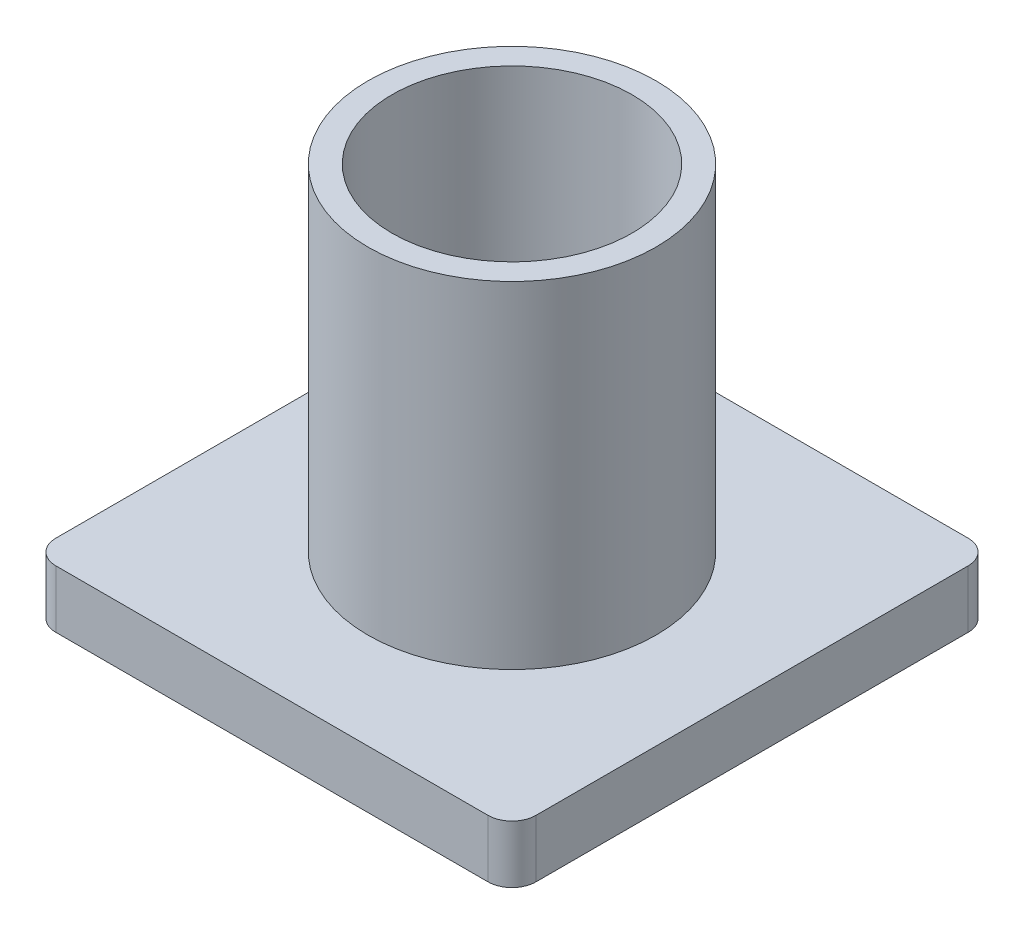
from build123d import *

# Parameters (mm, degrees)
BOSS_EXTRUDE1_DEPTH = 12
SKETCH3_R           = 30
BOSS_EXTRUDE2_DEPTH = 70
SKETCH4_R           = 25
CUT_EXTRUDE1_DEPTH  = 70


with BuildPart() as part:
    # Sketch1 → Boss-Extrude1 (new body)
    with BuildSketch(Plane(origin=(0, 0, 0), x_dir=(1, 0, 0), z_dir=(0, 1, 0))):
        with BuildLine():
            Line((-45, 50), (45, 50))
            ThreePointArc((45, 50), (48.535533906, 48.535533906), (50, 45))
            Line((50, 45), (50, -45))
            ThreePointArc((50, -45), (48.535533906, -48.535533906), (45, -50))
            Line((45, -50), (-45, -50))
            ThreePointArc((-45, -50), (-48.535533906, -48.535533906), (-50, -45))
            Line((-50, -45), (-50, 45))
            ThreePointArc((-50, 45), (-48.535533906, 48.535533906), (-45, 50))
        make_face()
    extrude(amount=BOSS_EXTRUDE1_DEPTH)

    # Sketch3 → Boss-Extrude2 (add)
    with BuildSketch(Plane(origin=(0, 12, 0), x_dir=(1, 0, 0), z_dir=(0, 1, 0))):
        with Locations(Location((0, 0, 0), (0, 0, 270))):
            Circle(SKETCH3_R)
    extrude(amount=BOSS_EXTRUDE2_DEPTH)

    # Sketch4 → Cut-Extrude1 (cut)
    with BuildSketch(Plane(origin=(0, 82, 0), x_dir=(1, 0, 0), z_dir=(0, 1, 0))):
        with Locations(Location((0, 0, 0), (0, 0, 270))):
            Circle(SKETCH4_R)
    extrude(amount=-CUT_EXTRUDE1_DEPTH, mode=Mode.SUBTRACT)


solid = part.part
